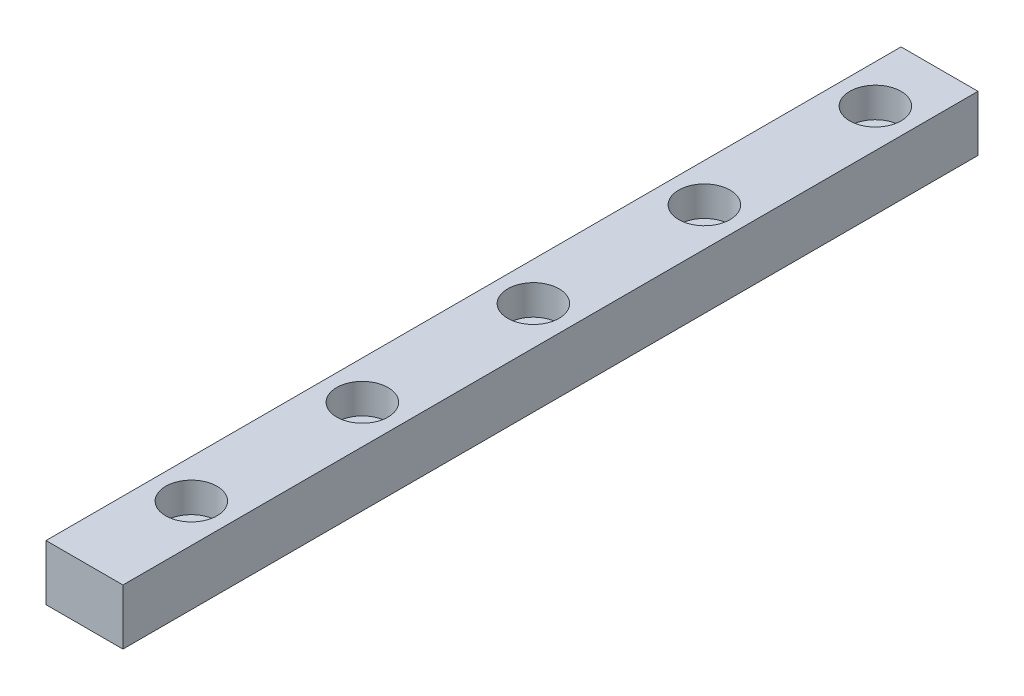
from build123d import *

# Parameters (mm, degrees)
SKETCH_1_W          = 9
SKETCH_1_H          = 6.5
EXTRUDE_1_DEPTH     = 100
SKETCH_2_R          = 1.750000006
CUT_EXTRUDE_1_DEPTH = 90.614230596
SKETCH_3_R          = 3.000000006
CUT_EXTRUDE_2_DEPTH = 3.5


with BuildPart() as part:
    # 草图1 → 凸台-拉伸1 (new body)
    with BuildSketch(Plane.XY.offset(-89.264832522)):
        Rectangle(SKETCH_1_W, SKETCH_1_H)
    extrude(amount=EXTRUDE_1_DEPTH)

    # 草图2 → 切除-拉伸1 (cut, through all)
    with BuildSketch(Plane(origin=(0, 3.25, 0), x_dir=(1, 0, 0), z_dir=(0, 1, 0))):
        with Locations(Location((0, 81.764832522, 0), (0, 0, 270))):
            Circle(SKETCH_2_R)
        with Locations(Location((0, 61.764832522, 0), (0, 0, 270))):
            Circle(SKETCH_2_R)
        with Locations(Location((0, 41.764832522, 0), (0, 0, 270))):
            Circle(SKETCH_2_R)
        with Locations(Location((0, 21.764832522, 0), (0, 0, 270))):
            Circle(SKETCH_2_R)
        with Locations(Location((0, 1.764832522, 0), (0, 0, 270))):
            Circle(SKETCH_2_R)
        with Locations((0, -18.235167478)):
            Circle(SKETCH_2_R)
        with Locations((0, -38.235167478)):
            Circle(SKETCH_2_R)
        with Locations((0, -58.235167478)):
            Circle(SKETCH_2_R)
        with Locations((0, -78.235167478)):
            Circle(SKETCH_2_R)
        with Locations((0, -98.235167478)):
            Circle(SKETCH_2_R)
        with Locations((0, -118.235167478)):
            Circle(SKETCH_2_R)
        with Locations((0, -138.235167478)):
            Circle(SKETCH_2_R)
        with Locations((0, -158.235167478)):
            Circle(SKETCH_2_R)
        with Locations((0, -178.235167478)):
            Circle(SKETCH_2_R)
        with Locations((0, -198.235167478)):
            Circle(SKETCH_2_R)
        with Locations((0, -218.235167478)):
            Circle(SKETCH_2_R)
        with Locations((0, -238.235167478)):
            Circle(SKETCH_2_R)
        with Locations((0, -258.235167478)):
            Circle(SKETCH_2_R)
        with Locations((0, -278.235167478)):
            Circle(SKETCH_2_R)
        with Locations((0, -298.235167478)):
            Circle(SKETCH_2_R)
        with Locations((0, -318.235167478)):
            Circle(SKETCH_2_R)
        with Locations((0, -338.235167478)):
            Circle(SKETCH_2_R)
        with Locations((0, -358.235167478)):
            Circle(SKETCH_2_R)
        with Locations((0, -378.235167478)):
            Circle(SKETCH_2_R)
        with Locations((0, -398.235167478)):
            Circle(SKETCH_2_R)
        with Locations((0, -418.235167478)):
            Circle(SKETCH_2_R)
        with Locations((0, -438.235167478)):
            Circle(SKETCH_2_R)
        with Locations((0, -458.235167478)):
            Circle(SKETCH_2_R)
        with Locations((0, -478.235167478)):
            Circle(SKETCH_2_R)
        with Locations((0, -498.235167478)):
            Circle(SKETCH_2_R)
        with Locations((0, -518.235167478)):
            Circle(SKETCH_2_R)
        with Locations((0, -538.235167478)):
            Circle(SKETCH_2_R)
        with Locations((0, -558.235167478)):
            Circle(SKETCH_2_R)
        with Locations((0, -578.235167478)):
            Circle(SKETCH_2_R)
        with Locations((0, -598.235167478)):
            Circle(SKETCH_2_R)
        with Locations((0, -618.235167478)):
            Circle(SKETCH_2_R)
        with Locations((0, -638.235167478)):
            Circle(SKETCH_2_R)
        with Locations((0, -658.235167478)):
            Circle(SKETCH_2_R)
        with Locations((0, -678.235167478)):
            Circle(SKETCH_2_R)
        with Locations((0, -698.235167478)):
            Circle(SKETCH_2_R)
        with Locations((0, -718.235167478)):
            Circle(SKETCH_2_R)
        with Locations((0, -738.235167478)):
            Circle(SKETCH_2_R)
        with Locations((0, -758.235167478)):
            Circle(SKETCH_2_R)
        with Locations((0, -778.235167478)):
            Circle(SKETCH_2_R)
        with Locations((0, -798.235167478)):
            Circle(SKETCH_2_R)
        with Locations((0, -818.235167478)):
            Circle(SKETCH_2_R)
        with Locations((0, -838.235167478)):
            Circle(SKETCH_2_R)
        with Locations((0, -858.235167478)):
            Circle(SKETCH_2_R)
        with Locations((0, -878.235167478)):
            Circle(SKETCH_2_R)
        with Locations((0, -898.235167478)):
            Circle(SKETCH_2_R)
        with Locations((0, -918.235167478)):
            Circle(SKETCH_2_R)
        with Locations((0, -938.235167478)):
            Circle(SKETCH_2_R)
        with Locations((0, -958.235167478)):
            Circle(SKETCH_2_R)
        with Locations((0, -978.235167478)):
            Circle(SKETCH_2_R)
        with Locations((0, -998.235167478)):
            Circle(SKETCH_2_R)
        with Locations((0, -1018.235167478)):
            Circle(SKETCH_2_R)
        with Locations((0, -1038.235167478)):
            Circle(SKETCH_2_R)
        with Locations((0, -1058.235167478)):
            Circle(SKETCH_2_R)
        with Locations((0, -1078.235167478)):
            Circle(SKETCH_2_R)
        with Locations((0, -1098.235167478)):
            Circle(SKETCH_2_R)
    extrude(amount=-CUT_EXTRUDE_1_DEPTH, mode=Mode.SUBTRACT)

    # 草图3 → 切除-拉伸2 (cut)
    with BuildSketch(Plane(origin=(0, 3.25, 0), x_dir=(1, 0, 0), z_dir=(0, 1, 0))):
        with Locations(Location((0, 81.764832522, 0), (0, 0, 270))):
            Circle(SKETCH_3_R)
        with Locations(Location((0, 61.764832522, 0), (0, 0, 270))):
            Circle(SKETCH_3_R)
        with Locations(Location((0, 41.764832522, 0), (0, 0, 270))):
            Circle(SKETCH_3_R)
        with Locations(Location((0, 21.764832522, 0), (0, 0, 270))):
            Circle(SKETCH_3_R)
        with Locations(Location((0, 1.764832522, 0), (0, 0, 270))):
            Circle(SKETCH_3_R)
        with Locations((0, -18.235167478)):
            Circle(SKETCH_3_R)
        with Locations((0, -38.235167478)):
            Circle(SKETCH_3_R)
        with Locations((0, -58.235167478)):
            Circle(SKETCH_3_R)
        with Locations((0, -78.235167478)):
            Circle(SKETCH_3_R)
        with Locations((0, -98.235167478)):
            Circle(SKETCH_3_R)
        with Locations((0, -118.235167478)):
            Circle(SKETCH_3_R)
        with Locations((0, -138.235167478)):
            Circle(SKETCH_3_R)
        with Locations((0, -158.235167478)):
            Circle(SKETCH_3_R)
        with Locations((0, -178.235167478)):
            Circle(SKETCH_3_R)
        with Locations((0, -198.235167478)):
            Circle(SKETCH_3_R)
        with Locations((0, -218.235167478)):
            Circle(SKETCH_3_R)
        with Locations((0, -238.235167478)):
            Circle(SKETCH_3_R)
        with Locations((0, -258.235167478)):
            Circle(SKETCH_3_R)
        with Locations((0, -278.235167478)):
            Circle(SKETCH_3_R)
        with Locations((0, -298.235167478)):
            Circle(SKETCH_3_R)
        with Locations((0, -318.235167478)):
            Circle(SKETCH_3_R)
        with Locations((0, -338.235167478)):
            Circle(SKETCH_3_R)
        with Locations((0, -358.235167478)):
            Circle(SKETCH_3_R)
        with Locations((0, -378.235167478)):
            Circle(SKETCH_3_R)
        with Locations((0, -398.235167478)):
            Circle(SKETCH_3_R)
        with Locations((0, -418.235167478)):
            Circle(SKETCH_3_R)
        with Locations((0, -438.235167478)):
            Circle(SKETCH_3_R)
        with Locations((0, -458.235167478)):
            Circle(SKETCH_3_R)
        with Locations((0, -478.235167478)):
            Circle(SKETCH_3_R)
        with Locations((0, -498.235167478)):
            Circle(SKETCH_3_R)
        with Locations((0, -518.235167478)):
            Circle(SKETCH_3_R)
        with Locations((0, -538.235167478)):
            Circle(SKETCH_3_R)
        with Locations((0, -558.235167478)):
            Circle(SKETCH_3_R)
        with Locations((0, -578.235167478)):
            Circle(SKETCH_3_R)
        with Locations((0, -598.235167478)):
            Circle(SKETCH_3_R)
        with Locations((0, -618.235167478)):
            Circle(SKETCH_3_R)
        with Locations((0, -638.235167478)):
            Circle(SKETCH_3_R)
        with Locations((0, -658.235167478)):
            Circle(SKETCH_3_R)
        with Locations((0, -678.235167478)):
            Circle(SKETCH_3_R)
        with Locations((0, -698.235167478)):
            Circle(SKETCH_3_R)
        with Locations((0, -718.235167478)):
            Circle(SKETCH_3_R)
        with Locations((0, -738.235167478)):
            Circle(SKETCH_3_R)
        with Locations((0, -758.235167478)):
            Circle(SKETCH_3_R)
        with Locations((0, -778.235167478)):
            Circle(SKETCH_3_R)
        with Locations((0, -798.235167478)):
            Circle(SKETCH_3_R)
        with Locations((0, -818.235167478)):
            Circle(SKETCH_3_R)
        with Locations((0, -838.235167478)):
            Circle(SKETCH_3_R)
        with Locations((0, -858.235167478)):
            Circle(SKETCH_3_R)
        with Locations((0, -878.235167478)):
            Circle(SKETCH_3_R)
        with Locations((0, -898.235167478)):
            Circle(SKETCH_3_R)
        with Locations((0, -918.235167478)):
            Circle(SKETCH_3_R)
        with Locations((0, -938.235167478)):
            Circle(SKETCH_3_R)
        with Locations((0, -958.235167478)):
            Circle(SKETCH_3_R)
        with Locations((0, -978.235167478)):
            Circle(SKETCH_3_R)
        with Locations((0, -998.235167478)):
            Circle(SKETCH_3_R)
        with Locations((0, -1018.235167478)):
            Circle(SKETCH_3_R)
        with Locations((0, -1038.235167478)):
            Circle(SKETCH_3_R)
        with Locations((0, -1058.235167478)):
            Circle(SKETCH_3_R)
        with Locations((0, -1078.235167478)):
            Circle(SKETCH_3_R)
        with Locations((0, -1098.235167478)):
            Circle(SKETCH_3_R)
    extrude(amount=-CUT_EXTRUDE_2_DEPTH, mode=Mode.SUBTRACT)


solid = part.part
